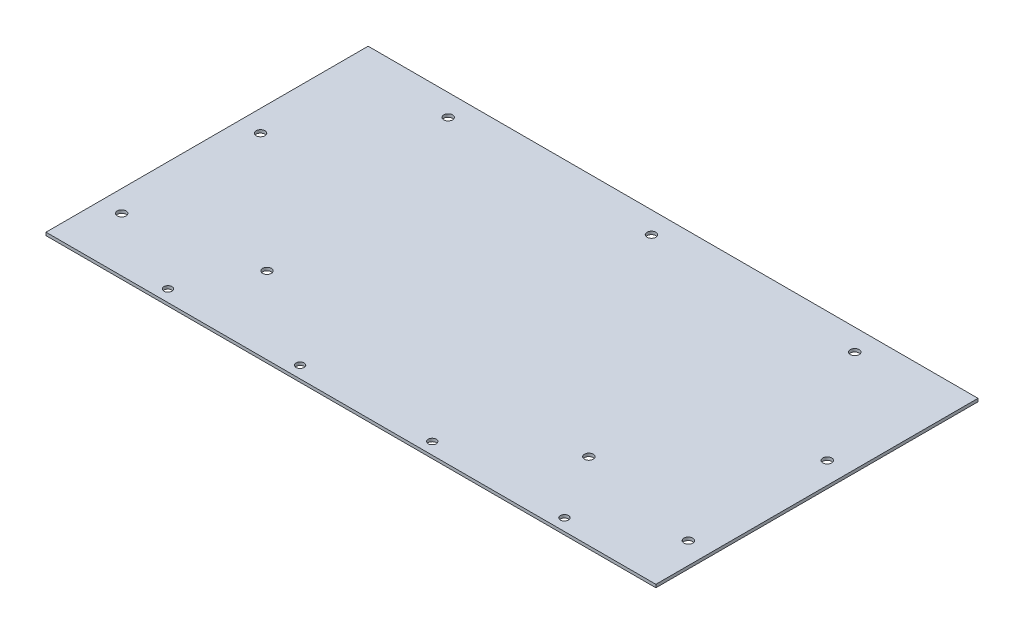
from build123d import *

# Parameters (mm, degrees)
SKETCH1_W            = 457.2
SKETCH1_H            = 2.286
BOSS_EXTRUDE1_DEPTH  = 238.315200026
SKETCH2_W            = 457.2
SKETCH2_H            = 2.286
BOSS_EXTRUDE2_DEPTH  = 3.175
SKETCH9_R            = 3
CUT_EXTRUDE10_DEPTH  = 2.54
LPATTERN1_COUNT      = 4
LPATTERN1_PITCH      = 99.06
M6_CLEARANCE_HOLE1_D = 6.6


with BuildPart() as part:
    # Sketch1 → Boss-Extrude1 (new body)
    with BuildSketch(Plane.XY):
        Rectangle(SKETCH1_W, SKETCH1_H)
    extrude(amount=BOSS_EXTRUDE1_DEPTH)

    # Sketch2 → Boss-Extrude2 (add)
    with BuildSketch(Plane(origin=(0, 0, 0), x_dir=(-1, 0, 0), z_dir=(0, 0, -1))):
        Rectangle(SKETCH2_W, SKETCH2_H)
    extrude(amount=BOSS_EXTRUDE2_DEPTH)

    # Sketch9 → Cut-Extrude10 (cut)
    with BuildSketch(Plane(origin=(0, 1.143, 0), x_dir=(1, 0, 0), z_dir=(0, 1, 0))):
        with Locations(Location((-146.05, -229.425200026, 0), (0, 0, 270))):
            Circle(SKETCH9_R)
    cut_extrude10 = extrude(amount=-CUT_EXTRUDE10_DEPTH, mode=Mode.SUBTRACT)

    # LPattern1: Cut-Extrude10 ×4
    with Locations(*[(i * LPATTERN1_PITCH, 0, 0) for i in range(1, LPATTERN1_COUNT)]):
        add(cut_extrude10, mode=Mode.SUBTRACT)

    # M6 Clearance Hole1 (through all)
    with Locations(Plane.XZ.offset(1.143)):
        with Locations((-212.419, 93.644793717), (-152.4, 13.0175), (0, 13.0175), (152.4, 13.0175), (212.419, 93.644793717), (212.419, 197.784793717), (120.65, 180.586), (-120.65, 180.586), (-212.419, 197.784793717)):
            Hole(M6_CLEARANCE_HOLE1_D / 2)


solid = part.part
